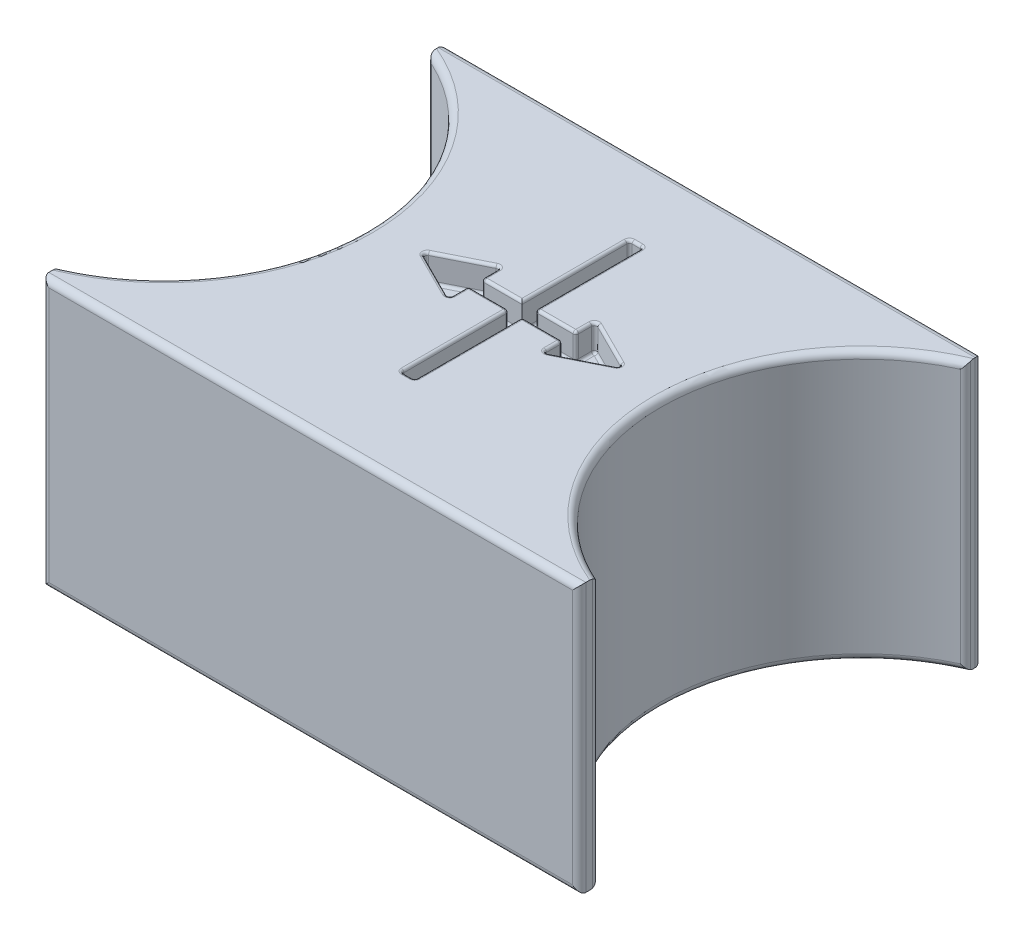
from build123d import *

# Parameters (mm, degrees)
SKETCH1_W           = 20
SKETCH1_H           = 15
BOSS_EXTRUDE1_DEPTH = 10
SKETCH2_R           = 7.5
CUT_EXTRUDE1_DEPTH  = 10
FILLET1_R           = 0.25
SKETCH3_R           = 2.5
CUT_EXTRUDE2_DEPTH  = 8
FILLET2_R           = 2
CUT_EXTRUDE3_DEPTH  = 1
FILLET3_R           = 0.1


with BuildPart() as part:
    # Sketch1 → Boss-Extrude1 (new body)
    with BuildSketch(Plane(origin=(0, 0, 0), x_dir=(1, 0, 0), z_dir=(0, 1, 0))):
        with Locations((-10, -7.5)):
            Rectangle(SKETCH1_W, SKETCH1_H)
    extrude(amount=BOSS_EXTRUDE1_DEPTH)

    # Sketch2 → Cut-Extrude1 (cut)
    with BuildSketch(Plane(origin=(0, 10, 0), x_dir=(1, 0, 0), z_dir=(0, 1, 0))):
        with Locations((-22.998438174, -7.458770099)):
            Circle(SKETCH2_R)
        with Locations((2.998438174, -7.458770099)):
            Circle(SKETCH2_R)
    extrude(amount=-CUT_EXTRUDE1_DEPTH, mode=Mode.SUBTRACT)

    # Fillet1
    fillet1_edges = [part.edges().sort_by_distance(p)[0] for p in [
        (-10, 10, 0),
        (-15.498438174, 10, 7.458770099),
        (-15.498438174, 0, 7.458770099),
        (-20, 5, 0.584225131),
        (-20, 5, 14.333315067),
        (-4.501561826, 10, 7.458770099),
        (-4.501561826, 0, 7.458770099),
        (0, 5, 14.333315067),
        (0, 5, 0.584225131),
        (-10, 0, 0),
        (-10, 0, 15),
        (-20, 5, 0),
        (0, 5, 0),
        (0, 5, 15),
        (-20, 5, 15),
        (-10, 10, 15),
    ]]
    fillet(fillet1_edges, radius=FILLET1_R)

    # Sketch3 → Cut-Extrude2 (cut)
    with BuildSketch(Plane.XZ):
        with Locations(Location((-10, 7.5, 0), (0, 0, 270))):
            Circle(SKETCH3_R)
    extrude(amount=-CUT_EXTRUDE2_DEPTH, mode=Mode.SUBTRACT)

    # Fillet2
    fillet2_edges = [part.edges().sort_by_distance(p)[0] for p in [
        (-10, 8, 10),
    ]]
    fillet(fillet2_edges, radius=FILLET2_R)

    # Sketch4 → Cut-Extrude3 (cut)
    with BuildSketch(Plane(origin=(0, 10, 0), x_dir=(1, 0, 0), z_dir=(0, 1, 0))):
        Polygon((-9.75, -7.375), (-8.25, -7.375), (-8.25, -8.125), (-6.25, -7.125), (-8.25, -6.125), (-8.25, -6.875), (-9.75, -6.875), (-9.75, -2.875), (-10.25, -2.875), (-10.25, -6.875), (-11.75, -6.875), (-11.75, -6.125), (-13.75, -7.125), (-11.75, -8.125), (-11.75, -7.375), (-10.25, -7.375), (-10.25, -11.375), (-9.75, -11.375), align=None)
    extrude(amount=-CUT_EXTRUDE3_DEPTH, mode=Mode.SUBTRACT)

    # Fillet3
    fillet3_edges = [part.edges().sort_by_distance(p)[0] for p in [
        (-10.25, 9, 4.875),
        (-10, 9, 2.875),
        (-10.25, 9.5, 2.875),
        (-9.75, 9, 4.875),
        (-9.75, 9.5, 2.875),
        (-9, 9, 6.875),
        (-9.75, 9.5, 6.875),
        (-8.25, 9, 6.5),
        (-8.25, 9.5, 6.875),
        (-7.25, 9, 6.625),
        (-8.25, 9.5, 6.125),
        (-7.25, 9, 7.625),
        (-6.25, 9.5, 7.125),
        (-8.25, 9, 7.75),
        (-8.25, 9.5, 8.125),
        (-9, 9, 7.375),
        (-8.25, 9.5, 7.375),
        (-9.75, 9, 9.375),
        (-9.75, 9.5, 7.375),
        (-10, 9, 11.375),
        (-9.75, 9.5, 11.375),
        (-10.25, 9, 9.375),
        (-10.25, 9.5, 11.375),
        (-11, 9, 7.375),
        (-10.25, 9.5, 7.375),
        (-11.75, 9, 7.75),
        (-11.75, 9.5, 7.375),
        (-12.75, 9, 7.625),
        (-11.75, 9.5, 8.125),
        (-12.75, 9, 6.625),
        (-13.75, 9.5, 7.125),
        (-11.75, 9, 6.5),
        (-11.75, 9.5, 6.125),
        (-11, 9, 6.875),
        (-11.75, 9.5, 6.875),
        (-10.25, 10, 4.875),
        (-11, 10, 6.875),
        (-11.75, 10, 6.5),
        (-12.75, 10, 6.625),
        (-12.75, 10, 7.625),
        (-11.75, 10, 7.75),
        (-11, 10, 7.375),
        (-10.25, 10, 9.375),
        (-10, 10, 11.375),
        (-9.75, 10, 9.375),
        (-9, 10, 7.375),
        (-8.25, 10, 7.75),
        (-7.25, 10, 7.625),
        (-7.25, 10, 6.625),
        (-8.25, 10, 6.5),
        (-9, 10, 6.875),
        (-9.75, 10, 4.875),
        (-10, 10, 2.875),
    ]]
    fillet(fillet3_edges, radius=FILLET3_R)


solid = part.part
